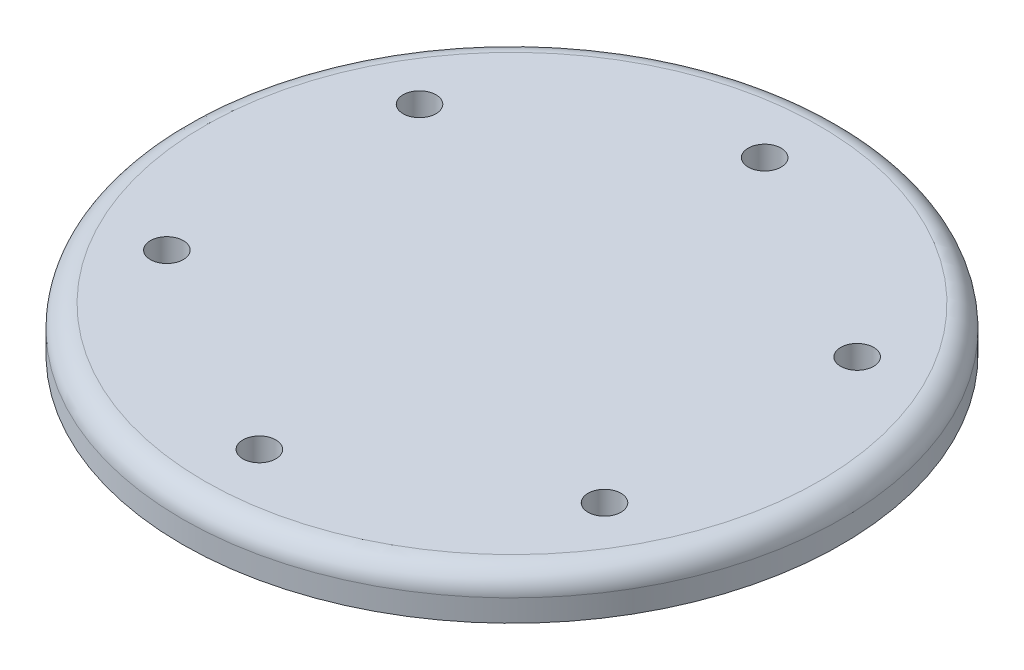
from build123d import *

# Parameters (mm, degrees)
SKETCH1_R           = 30
SKETCH1_R_2         = 1.5
BOSS_EXTRUDE1_DEPTH = 4
FILLET1_R           = 2


with BuildPart() as part:
    # Sketch1 → Boss-Extrude1 (new body)
    with BuildSketch(Plane(origin=(0, 0, 0), x_dir=(1, 0, 0), z_dir=(0, 1, 0))):
        with Locations(Location((0, 0, 0), (0, 0, 270))):
            Circle(SKETCH1_R)
        with Locations(Location((0, 23, 0), (0, 0, 270))):
            Circle(SKETCH1_R_2, mode=Mode.SUBTRACT)
        with Locations(Location((19.919084287, 11.500866025, 0), (0, 0, 270))):
            Circle(SKETCH1_R_2, mode=Mode.SUBTRACT)
        with Locations(Location((19.920084287, -11.499133975, 0), (0, 0, 270))):
            Circle(SKETCH1_R_2, mode=Mode.SUBTRACT)
        with Locations(Location((0.002, -23, 0), (0, 0, 270))):
            Circle(SKETCH1_R_2, mode=Mode.SUBTRACT)
        with Locations(Location((-19.917084287, -11.500866025, 0), (0, 0, 270))):
            Circle(SKETCH1_R_2, mode=Mode.SUBTRACT)
        with Locations(Location((-19.918084287, 11.499133975, 0), (0, 0, 270))):
            Circle(SKETCH1_R_2, mode=Mode.SUBTRACT)
    extrude(amount=BOSS_EXTRUDE1_DEPTH)

    # Fillet1
    fillet1_edges = [part.edges().sort_by_distance(p)[0] for p in [
        (0, 4, -30),
    ]]
    fillet(fillet1_edges, radius=FILLET1_R)


solid = part.part
